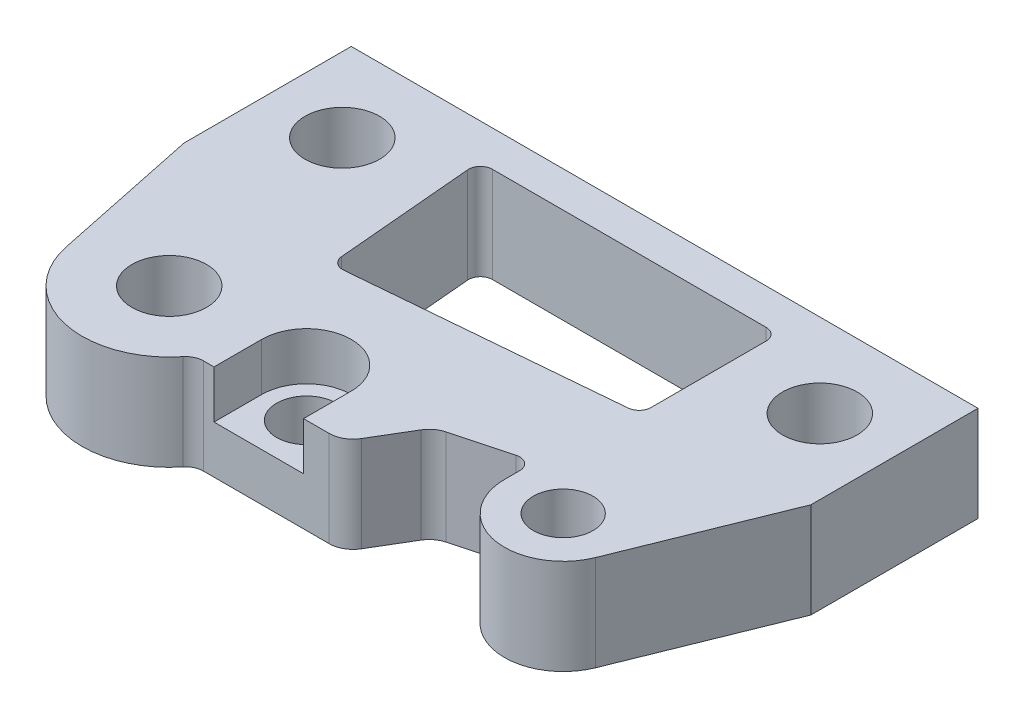
from build123d import *

# Parameters (mm, degrees)
SKETCH3_R           = 3.96875
SKETCH3_R_2         = 3.175
BOSS_EXTRUDE4_DEPTH = 10.16
CUT_EXTRUDE3_DEPTH  = 5.08


with BuildPart() as part:
    # Sketch3 → Boss-Extrude4 (new body)
    with BuildSketch(Plane(origin=(0, 0, 0), x_dir=(1, 0, 0), z_dir=(0, 1, 0))):
        with BuildLine():
            Line((54.2925, 31.75), (-12.3825, 31.75))
            Line((-12.3825, 31.75), (-12.3825, 13.97))
            Line((-12.3825, 13.97), (-9.075895852, -1.891971323))
            ThreePointArc((-9.075895852, -1.891971323), (-2.156945737, -9.016597256), (7.237172055, -5.794375))
            ThreePointArc((7.237172055, -5.794375), (7.899373007, -5.267856205), (8.724262204, -5.08))
            Line((8.724262204, -5.08), (22.098, -5.08))
            ThreePointArc((22.098, -5.08), (23.352279932, -4.748705923), (24.279366546, -3.841245553))
            Line((24.279366546, -3.841245553), (26.647633454, 0.128841561))
            ThreePointArc((26.647633454, 0.128841561), (27.298361404, 0.854600075), (28.174517214, 1.281827513))
            Line((28.174517214, 1.281827513), (34.065158638, 2.852715753))
            ThreePointArc((34.065158638, 2.852715753), (35.166125897, 2.632698945), (35.662400031, 1.6256))
            Line((35.662400031, 1.6256), (35.662400031, 0))
            ThreePointArc((35.662400031, 0), (40.717901726, -6.132813961), (47.702673821, -2.340392141))
            Line((47.702673821, -2.340392141), (54.2925, 13.97))
            Line((54.2925, 13.97), (54.2925, 31.75))
        make_face()
        Circle(SKETCH3_R, mode=Mode.SUBTRACT)
        with Locations((-4.445, 22.86)):
            Circle(SKETCH3_R, mode=Mode.SUBTRACT)
        with Locations((46.355, 22.86)):
            Circle(SKETCH3_R, mode=Mode.SUBTRACT)
        with Locations((41.91, 0)):
            Circle(SKETCH3_R_2, mode=Mode.SUBTRACT)
        with BuildLine():
            Line((17.774504023, -0.186733089), (15.513562514, 3.04222602))
            ThreePointArc((15.513562514, 3.04222602), (12.004192259, -1.821105185), (17.774504023, -0.186733089))
        make_face(mode=Mode.SUBTRACT)
        with BuildLine():
            Line((36.83, 14.42919116), (36.83, 26.67))
            ThreePointArc((36.83, 26.67), (36.458025612, 27.568025612), (35.56, 27.94))
            Line((35.56, 27.94), (6.442341733, 27.94))
            ThreePointArc((6.442341733, 27.94), (5.505999515, 27.527999564), (5.177174467, 26.559312207))
            Line((5.177174467, 26.559312207), (6.461152869, 11.883371914))
            ThreePointArc((6.461152869, 11.883371914), (6.909979871, 11.021183265), (7.837007929, 10.728892441))
            Line((7.837007929, 10.728892441), (35.670687793, 13.164023894))
            ThreePointArc((35.670687793, 13.164023894), (36.496342218, 13.571191596), (36.83, 14.42919116))
        make_face(mode=Mode.SUBTRACT)
    extrude(amount=BOSS_EXTRUDE4_DEPTH)

    # Sketch5 → Cut-Extrude3 (cut)
    with BuildSketch(Plane(origin=(0, 10.16, 0), x_dir=(1, 0, 0), z_dir=(0, 1, 0))):
        with BuildLine():
            Line((19.3675, 0), (19.3675, -5.08))
            Line((19.3675, -5.08), (9.8425, -5.08))
            Line((9.8425, -5.08), (9.8425, 0))
            ThreePointArc((9.8425, 0), (14.605, 4.7625), (19.3675, 0))
        make_face()
    extrude(amount=-CUT_EXTRUDE3_DEPTH, mode=Mode.SUBTRACT)


solid = part.part
